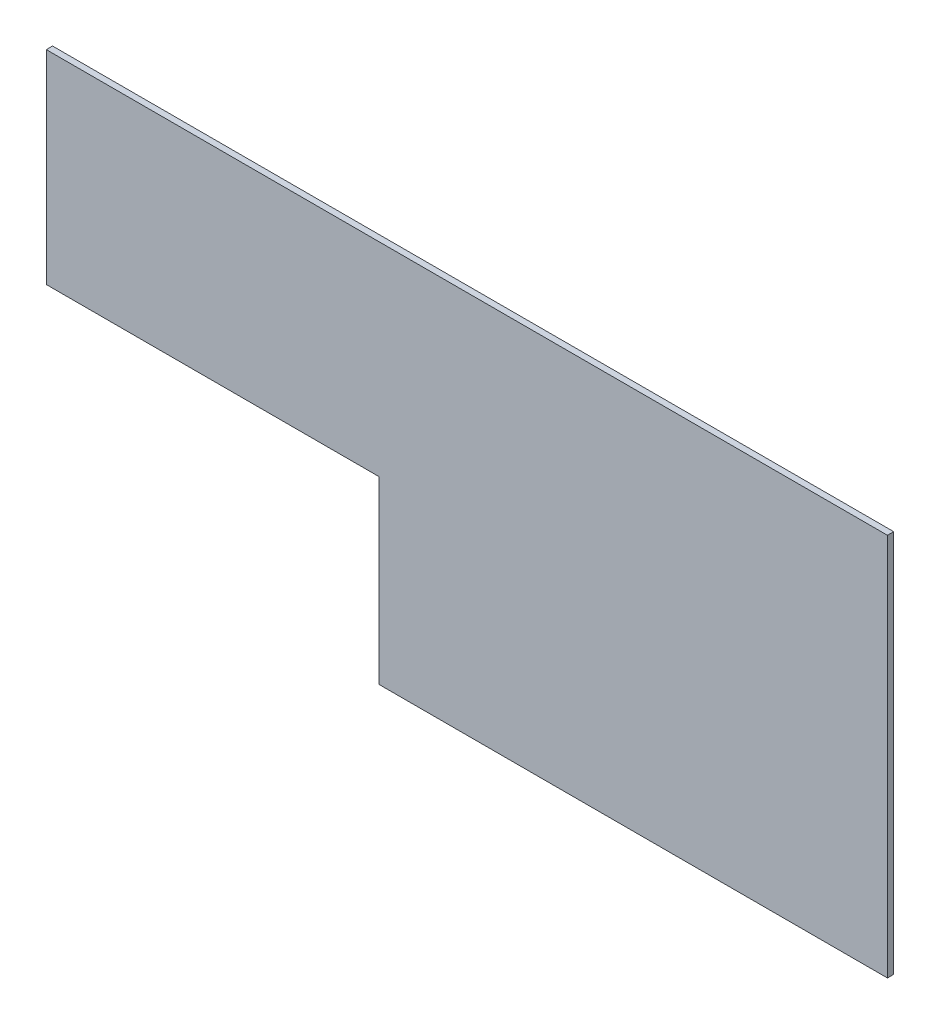
from build123d import *

# Parameters (mm, degrees)
BOSS_EXTRUDE1_DEPTH = 1.6


with BuildPart() as part:
    # Sketch1 → Boss-Extrude1 (new body)
    with BuildSketch(Plane.XY):
        Polygon((4.394386723, 47.769443855), (89.394386723, 47.769443855), (89.394386723, 1.769443855), (219.394386723, 1.769443855), (219.394386723, 99.769443855), (4.394386723, 99.769443855), align=None)
    extrude(amount=BOSS_EXTRUDE1_DEPTH)


solid = part.part
